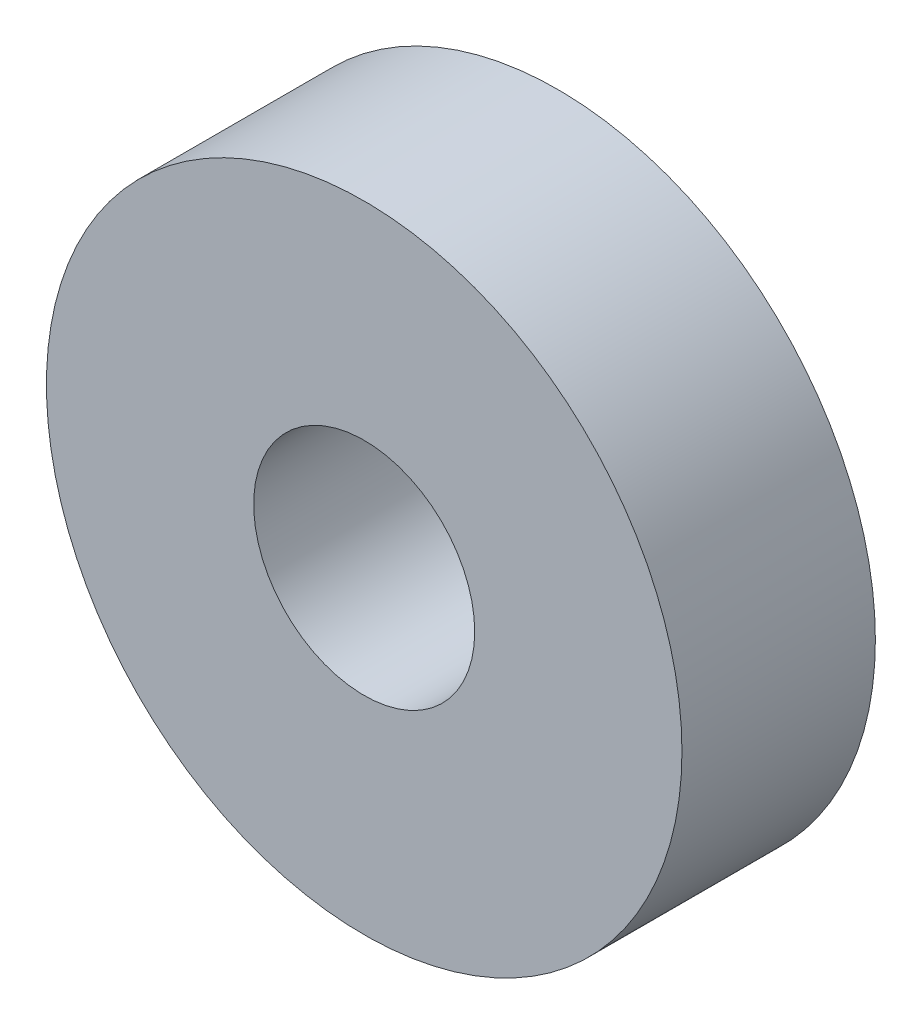
from build123d import *

# Parameters (mm, degrees)
SKETCH1_R           = 11.5
SKETCH1_R_2         = 4
BOSS_EXTRUDE1_DEPTH = 7


with BuildPart() as part:
    # Sketch1 → Boss-Extrude1 (new body)
    with BuildSketch(Plane.XY):
        Circle(SKETCH1_R)
        Circle(SKETCH1_R_2, mode=Mode.SUBTRACT)
    extrude(amount=BOSS_EXTRUDE1_DEPTH)


solid = part.part
